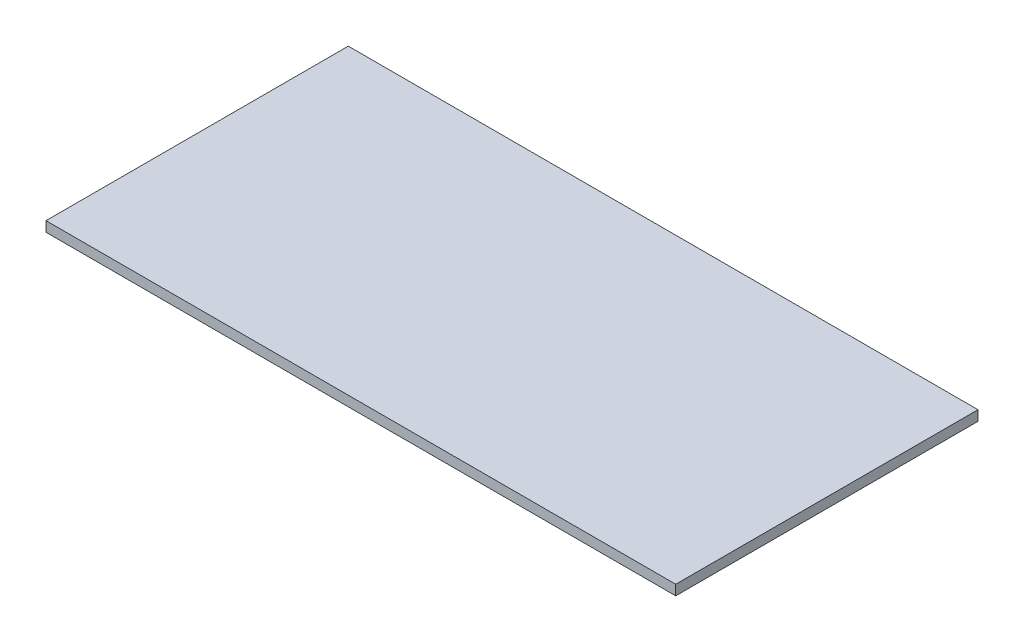
from build123d import *

# Parameters (mm, degrees)
SKETCH1_W           = 1250
SKETCH1_H           = 600
BOSS_EXTRUDE3_DEPTH = 20
SKETCH6_W           = 1130
SKETCH6_H           = 500
SKETCH6_W_2         = 1030
SKETCH6_H_2         = 400
CUT_EXTRUDE6_DEPTH  = 1


with BuildPart() as part:
    # Sketch1 → Boss-Extrude3 (new body)
    with BuildSketch(Plane(origin=(0, 0, 0), x_dir=(1, 0, 0), z_dir=(0, 1, 0))):
        Rectangle(SKETCH1_W, SKETCH1_H)
    extrude(amount=BOSS_EXTRUDE3_DEPTH)

    # Sketch6 → Cut-Extrude6 (cut)
    with BuildSketch(Plane.XZ):
        Rectangle(SKETCH6_W, SKETCH6_H)
        Rectangle(SKETCH6_W_2, SKETCH6_H_2, mode=Mode.SUBTRACT)
    extrude(amount=-CUT_EXTRUDE6_DEPTH, mode=Mode.SUBTRACT)


solid = part.part
